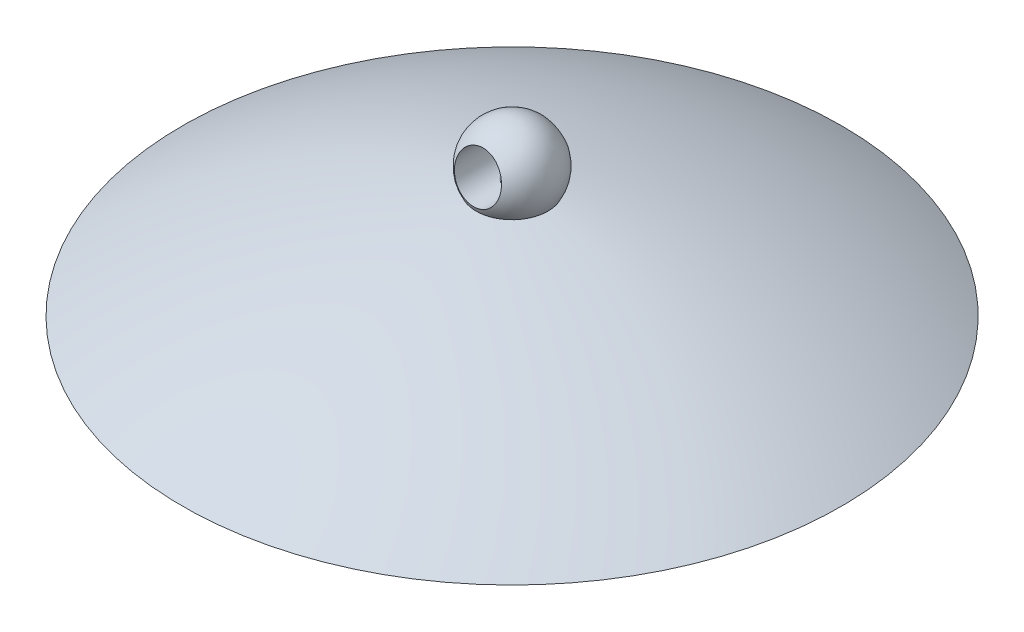
from build123d import *

# Parameters (mm, degrees)
CORTE_EXTRUS_O1_DEPTH      = 81.636539008
CORTE_EXTRUS_O1_DEPTH_BACK = 81.636539008
ESBO_O2_R                  = 3.743138016


with BuildPart() as part:
    # Esboço1 → Revolução1 (revolve)
    with BuildSketch(Plane.XY, mode=Mode.PRIVATE) as revolu_o1_sk:
        with BuildLine():
            Line((0, 0), (-53.5, 0))
            ThreePointArc((-53.5, 0), (-30.517217815, 11.119479738), (-5.834384509, 17.64702496))
            ThreePointArc((-5.834384509, 17.64702496), (-5.893250367, 24.463067251), (0, 27.888194666))
            Line((0, 27.888194666), (0, 25.698667422))
            Line((0, 25.698667422), (0, 23.888194666))
            ThreePointArc((0, 23.888194666), (-2.782506468, 21.105688198), (0, 18.323181729))
            Line((0, 18.323181729), (0, 0))
        make_face()
    revolve(revolu_o1_sk.sketch.rotate(Axis((0, 0, 0), (0, 1, 0)), 270), axis=Axis((0, 0, 0), (0, 1, 0)))

    # Esboço2 → Corte-extrusão1 (cut, two sides: drawn at the far end of the back side and taken through both)
    with BuildSketch(Plane.XY.offset(-CORTE_EXTRUS_O1_DEPTH_BACK)):
        with Locations(Location((0, 22.244634325, 0), (0, 0, 222.797655558))):
            Circle(ESBO_O2_R)
    extrude(amount=CORTE_EXTRUS_O1_DEPTH + CORTE_EXTRUS_O1_DEPTH_BACK, mode=Mode.SUBTRACT)


solid = part.part
